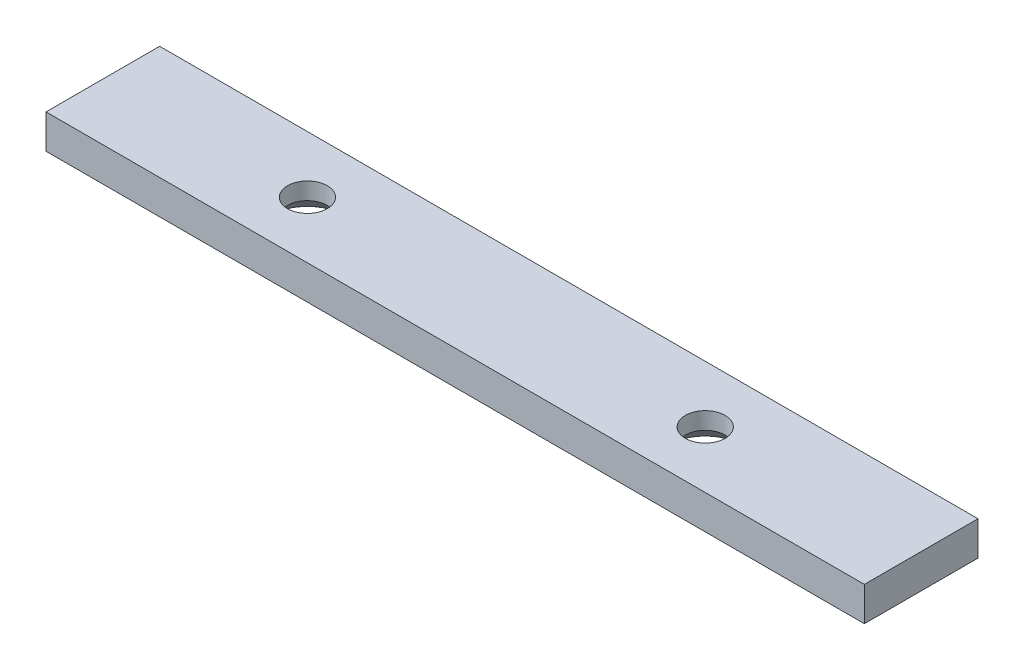
from build123d import *

# Parameters (mm, degrees)
SKETCH1_W           = 144
SKETCH1_H           = 20
BOSS_EXTRUDE1_DEPTH = 6
LPATTERN1_COUNT     = 2
LPATTERN1_PITCH     = 70


with BuildPart() as part:
    # Sketch1 → Boss-Extrude1 (new body)
    with BuildSketch(Plane(origin=(0, 0, 0), x_dir=(1, 0, 0), z_dir=(0, 1, 0))):
        Rectangle(SKETCH1_W, SKETCH1_H)
    extrude(amount=BOSS_EXTRUDE1_DEPTH)

    # Sketch3 → CSK for M1.6 Countersunk Flat Head Screw1 (revolve, cut)
    with BuildSketch(Plane(origin=(34, 0, 0), x_dir=(0, 0, -1), z_dir=(1, 0, 0))):
        Polygon((0, 0), (0, 6), (3.5, 6), (3.5, 3), (6.5, 0), align=None)
    csk_for_m1_6_countersunk_flat_head_screw = revolve(axis=Axis((34, -6.35, 0), (0, 1, 0)), mode=Mode.SUBTRACT)

    # LPattern1: CSK for M1.6 Countersunk Flat Head Screw1 ×2
    with Locations(*[(-i * LPATTERN1_PITCH, 0, 0) for i in range(1, LPATTERN1_COUNT)]):
        add(csk_for_m1_6_countersunk_flat_head_screw, mode=Mode.SUBTRACT)


solid = part.part
